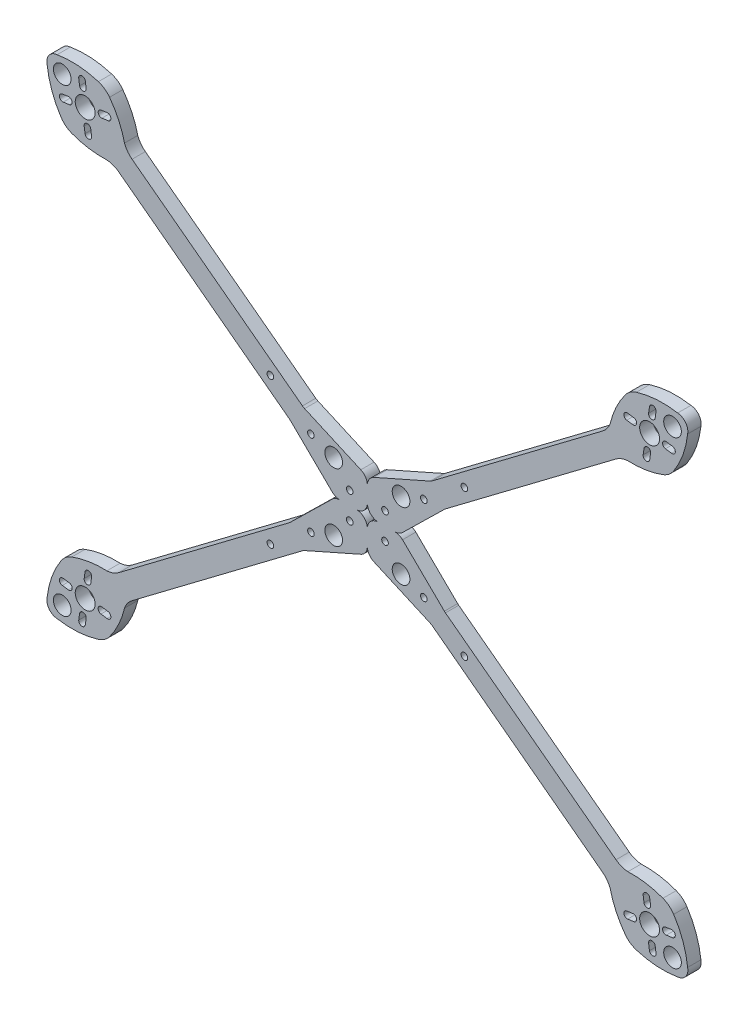
from build123d import *

# Parameters (mm, degrees)
CROQUIS1_R              = 4
CROQUIS1_R_2            = 4.5
CROQUIS1_R_3            = 1.5
SALIENTE_EXTRUIR1_DEPTH = 6


with BuildPart() as part:
    # Croquis1 → Saliente-Extruir1 (new body)
    with BuildSketch(Plane.XY):
        with BuildLine():
            ThreePointArc((-124.30149571, 56.412363794), (-122.413191065, 56.782643979), (-120.804567137, 57.838641566))
            Line((-120.804567137, 57.838641566), (-101.858135084, 76.377944673))
            ThreePointArc((-101.858135084, 76.377944673), (-101.620962129, 76.595527407), (-101.370281627, 76.797399996))
            Line((-101.370281627, 76.797399996), (-24.160029782, 134.979497983))
            ThreePointArc((-24.160029782, 134.979497983), (-21.611419756, 136.371964278), (-18.770175683, 136.973385563))
            ThreePointArc((-18.770175683, 136.973385563), (-10.706717103, 137.416502238), (-2.896595227, 139.470209357))
            ThreePointArc((-2.896595227, 139.470209357), (-0.16079463, 141.022813745), (1.957331737, 143.348480526))
            ThreePointArc((1.957331737, 143.348480526), (6.169165818, 151.795844616), (8.284256186, 160.994969527))
            ThreePointArc((8.284256186, 160.994969527), (7.378957738, 165.006508056), (3.772353479, 166.98246665))
            ThreePointArc((3.772353479, 166.98246665), (-5.653410851, 167.484933762), (-14.934477191, 165.764668091))
            ThreePointArc((-14.934477191, 165.764668091), (-17.753886337, 164.36963499), (-20.000434306, 162.167770437))
            ThreePointArc((-20.000434306, 162.167770437), (-24.127345636, 155.226277836), (-26.775887124, 147.597323475))
            ThreePointArc((-26.775887124, 147.597323475), (-28.137163373, 145.031918552), (-30.178180014, 142.965853083))
            Line((-30.178180014, 142.965853083), (-107.335086675, 84.823953575))
            ThreePointArc((-107.335086675, 84.823953575), (-107.810669131, 84.506514587), (-108.319384217, 84.245449184))
            Line((-108.319384217, 84.245449184), (-133.755116638, 72.980076558))
            ThreePointArc((-133.755116638, 72.980076558), (-135.921036372, 71.135674592), (-136.730339063, 68.408394616))
            ThreePointArc((-136.730339063, 68.408394616), (-137.539641754, 71.135674592), (-139.705561488, 72.980076558))
            Line((-139.705561488, 72.980076558), (-165.141293909, 84.245449184))
            ThreePointArc((-165.141293909, 84.245449184), (-165.650008995, 84.506514587), (-166.125591451, 84.823953575))
            Line((-166.125591451, 84.823953575), (-243.282498112, 142.965853083))
            ThreePointArc((-243.282498112, 142.965853083), (-245.323514753, 145.031918552), (-246.684791002, 147.597323475))
            ThreePointArc((-246.684791002, 147.597323475), (-249.33333249, 155.226277836), (-253.46024382, 162.167770437))
            ThreePointArc((-253.46024382, 162.167770437), (-255.706791789, 164.36963499), (-258.526200935, 165.764668091))
            ThreePointArc((-258.526200935, 165.764668091), (-267.807267276, 167.484933762), (-277.233031605, 166.98246665))
            ThreePointArc((-277.233031605, 166.98246665), (-280.839635864, 165.006508056), (-281.744934312, 160.994969527))
            ThreePointArc((-281.744934312, 160.994969527), (-279.629843944, 151.795844616), (-275.418009863, 143.348480526))
            ThreePointArc((-275.418009863, 143.348480526), (-273.299883496, 141.022813745), (-270.564082899, 139.470209357))
            ThreePointArc((-270.564082899, 139.470209357), (-262.753961023, 137.416502238), (-254.690502443, 136.973385563))
            ThreePointArc((-254.690502443, 136.973385563), (-251.84925837, 136.371964278), (-249.300648344, 134.979497983))
            Line((-249.300648344, 134.979497983), (-172.090396499, 76.797399996))
            ThreePointArc((-172.090396499, 76.797399996), (-171.839715997, 76.595527407), (-171.602543042, 76.377944673))
            Line((-171.602543042, 76.377944673), (-152.656110989, 57.838641566))
            ThreePointArc((-152.656110989, 57.838641566), (-151.047487061, 56.782643979), (-149.159182416, 56.412363794))
            ThreePointArc((-149.159182416, 56.412363794), (-151.047487061, 56.042083609), (-152.656110989, 54.986086021))
            Line((-152.656110989, 54.986086021), (-171.602543042, 36.446782915))
            ThreePointArc((-171.602543042, 36.446782915), (-171.839715997, 36.229200181), (-172.090396499, 36.027327592))
            Line((-172.090396499, 36.027327592), (-249.300648344, -22.154770395))
            ThreePointArc((-249.300648344, -22.154770395), (-251.84925837, -23.54723669), (-254.690502443, -24.148657976))
            ThreePointArc((-254.690502443, -24.148657976), (-262.753961023, -24.591774651), (-270.564082899, -26.645481769))
            ThreePointArc((-270.564082899, -26.645481769), (-273.299883496, -28.198086157), (-275.418009863, -30.523752939))
            ThreePointArc((-275.418009863, -30.523752939), (-279.629843944, -38.971117028), (-281.744934312, -48.170241939))
            ThreePointArc((-281.744934312, -48.170241939), (-280.839635864, -52.181780468), (-277.233031605, -54.157739063))
            ThreePointArc((-277.233031605, -54.157739063), (-267.807267276, -54.660206174), (-258.526200935, -52.939940504))
            ThreePointArc((-258.526200935, -52.939940504), (-255.706791789, -51.544907402), (-253.46024382, -49.343042849))
            ThreePointArc((-253.46024382, -49.343042849), (-249.33333249, -42.401550248), (-246.684791002, -34.772595888))
            ThreePointArc((-246.684791002, -34.772595888), (-245.323514753, -32.207190964), (-243.282498112, -30.141125496))
            Line((-243.282498112, -30.141125496), (-166.125591451, 28.000774013))
            ThreePointArc((-166.125591451, 28.000774013), (-165.650008995, 28.318213001), (-165.141293909, 28.579278404))
            Line((-165.141293909, 28.579278404), (-139.705561488, 39.84465103))
            ThreePointArc((-139.705561488, 39.84465103), (-137.539641754, 41.689052996), (-136.730339063, 44.416332971))
            ThreePointArc((-136.730339063, 44.416332971), (-135.921036372, 41.689052996), (-133.755116638, 39.84465103))
            Line((-133.755116638, 39.84465103), (-108.319384217, 28.579278404))
            ThreePointArc((-108.319384217, 28.579278404), (-107.810669131, 28.318213001), (-107.335086675, 28.000774013))
            Line((-107.335086675, 28.000774013), (-30.178180014, -30.141125496))
            ThreePointArc((-30.178180014, -30.141125496), (-28.137163373, -32.207190964), (-26.775887124, -34.772595888))
            ThreePointArc((-26.775887124, -34.772595888), (-24.127345636, -42.401550248), (-20.000434306, -49.343042849))
            ThreePointArc((-20.000434306, -49.343042849), (-17.753886337, -51.544907402), (-14.934477191, -52.939940504))
            ThreePointArc((-14.934477191, -52.939940504), (-5.653410851, -54.660206174), (3.772353479, -54.157739063))
            ThreePointArc((3.772353479, -54.157739063), (7.378957738, -52.181780468), (8.284256186, -48.170241939))
            ThreePointArc((8.284256186, -48.170241939), (6.169165818, -38.971117028), (1.957331737, -30.523752939))
            ThreePointArc((1.957331737, -30.523752939), (-0.16079463, -28.198086157), (-2.896595227, -26.645481769))
            ThreePointArc((-2.896595227, -26.645481769), (-10.706717103, -24.591774651), (-18.770175683, -24.148657976))
            ThreePointArc((-18.770175683, -24.148657976), (-21.611419756, -23.54723669), (-24.160029782, -22.154770395))
            Line((-24.160029782, -22.154770395), (-101.370281627, 36.027327592))
            ThreePointArc((-101.370281627, 36.027327592), (-101.620962129, 36.229200181), (-101.858135084, 36.446782915))
            Line((-101.858135084, 36.446782915), (-120.804567137, 54.986086021))
            ThreePointArc((-120.804567137, 54.986086021), (-122.413191065, 56.042083609), (-124.30149571, 56.412363794))
        make_face()
        with BuildLine():
            ThreePointArc((-141.730339063, 56.412363794), (-138.194805157, 57.876829888), (-136.730339063, 61.412363794))
            ThreePointArc((-136.730339063, 61.412363794), (-135.265872969, 57.876829888), (-131.730339063, 56.412363794))
            ThreePointArc((-131.730339063, 56.412363794), (-135.265872969, 54.9478977), (-136.730339063, 51.412363794))
            ThreePointArc((-136.730339063, 51.412363794), (-138.194805157, 54.9478977), (-141.730339063, 56.412363794))
        make_face(mode=Mode.SUBTRACT)
        with Locations((-274.894282301, -47.701635211)):
            Circle(CROQUIS1_R, mode=Mode.SUBTRACT)
        with BuildLine():
            ThreePointArc((-267.034262376, -47.046777371), (-265.340100621, -45.770134919), (-264.063458169, -47.464296674))
            Line((-264.063458169, -47.464296674), (-264.453142852, -50.237047266))
            ThreePointArc((-264.453142852, -50.237047266), (-266.147304607, -51.513689718), (-267.423947058, -49.819527963))
            Line((-267.423947058, -49.819527963), (-267.034262376, -47.046777371))
        make_face(mode=Mode.SUBTRACT)
        with BuildLine():
            ThreePointArc((-271.680758131, -37.355798205), (-270.404115679, -39.04995996), (-272.098277434, -40.326602411))
            Line((-272.098277434, -40.326602411), (-274.871028026, -39.936917729))
            ThreePointArc((-274.871028026, -39.936917729), (-276.147670478, -38.242755974), (-274.453508724, -36.966113522))
            Line((-274.453508724, -36.966113522), (-271.680758131, -37.355798205))
        make_face(mode=Mode.SUBTRACT)
        with Locations((-264.51202067, -39.87803991)):
            Circle(CROQUIS1_R_2, mode=Mode.SUBTRACT)
        with BuildLine():
            ThreePointArc((-257.34328321, -42.400281616), (-258.619925661, -40.706119861), (-256.925763907, -39.429477409))
            Line((-256.925763907, -39.429477409), (-254.153013314, -39.819162092))
            ThreePointArc((-254.153013314, -39.819162092), (-252.876370863, -41.513323847), (-254.570532617, -42.789966298))
            Line((-254.570532617, -42.789966298), (-257.34328321, -42.400281616))
        make_face(mode=Mode.SUBTRACT)
        with BuildLine():
            ThreePointArc((-261.989778965, -32.70930245), (-263.68394072, -33.985944901), (-264.960583171, -32.291783147))
            Line((-264.960583171, -32.291783147), (-264.570898489, -29.519032554))
            ThreePointArc((-264.570898489, -29.519032554), (-262.876736734, -28.242390103), (-261.600094282, -29.936551857))
            Line((-261.600094282, -29.936551857), (-261.989778965, -32.70930245))
        make_face(mode=Mode.SUBTRACT)
        with Locations((-180.655292116, 23.312537521)):
            Circle(CROQUIS1_R_3, mode=Mode.SUBTRACT)
        with Locations((-162.290622468, 37.151308712)):
            Circle(CROQUIS1_R_3, mode=Mode.SUBTRACT)
        with Locations((-151.980339063, 41.162363794)):
            Circle(CROQUIS1_R, mode=Mode.SUBTRACT)
        with Locations((-144.716694164, 50.394213562)):
            Circle(CROQUIS1_R_3, mode=Mode.SUBTRACT)
        with Locations((-144.716694164, 62.430514025)):
            Circle(CROQUIS1_R_3, mode=Mode.SUBTRACT)
        with Locations((-162.290622468, 75.673418875)):
            Circle(CROQUIS1_R_3, mode=Mode.SUBTRACT)
        with Locations((-151.980339063, 71.662363794)):
            Circle(CROQUIS1_R, mode=Mode.SUBTRACT)
        with Locations((-180.655292116, 89.512190067)):
            Circle(CROQUIS1_R_3, mode=Mode.SUBTRACT)
        with BuildLine():
            Line((-261.989778965, 145.534030037), (-261.600094282, 142.761279445))
            ThreePointArc((-261.600094282, 142.761279445), (-262.876736734, 141.06711769), (-264.570898489, 142.343760142))
            Line((-264.570898489, 142.343760142), (-264.960583171, 145.116510735))
            ThreePointArc((-264.960583171, 145.116510735), (-263.68394072, 146.810672489), (-261.989778965, 145.534030037))
        make_face(mode=Mode.SUBTRACT)
        with BuildLine():
            Line((-271.680758131, 150.180525793), (-274.453508724, 149.79084111))
            ThreePointArc((-274.453508724, 149.79084111), (-276.147670478, 151.067483562), (-274.871028026, 152.761645316))
            Line((-274.871028026, 152.761645316), (-272.098277434, 153.151329999))
            ThreePointArc((-272.098277434, 153.151329999), (-270.404115679, 151.874687547), (-271.680758131, 150.180525793))
        make_face(mode=Mode.SUBTRACT)
        with Locations((-264.51202067, 152.702767498)):
            Circle(CROQUIS1_R_2, mode=Mode.SUBTRACT)
        with Locations((-274.894282301, 160.526362799)):
            Circle(CROQUIS1_R, mode=Mode.SUBTRACT)
        with BuildLine():
            Line((-267.034262376, 159.871504959), (-267.423947058, 162.644255551))
            ThreePointArc((-267.423947058, 162.644255551), (-266.147304607, 164.338417306), (-264.453142852, 163.061774854))
            Line((-264.453142852, 163.061774854), (-264.063458169, 160.289024262))
            ThreePointArc((-264.063458169, 160.289024262), (-265.340100621, 158.594862507), (-267.034262376, 159.871504959))
        make_face(mode=Mode.SUBTRACT)
        with BuildLine():
            Line((-257.34328321, 155.225009203), (-254.570532617, 155.614693886))
            ThreePointArc((-254.570532617, 155.614693886), (-252.876370863, 154.338051434), (-254.153013314, 152.64388968))
            Line((-254.153013314, 152.64388968), (-256.925763907, 152.254204997))
            ThreePointArc((-256.925763907, 152.254204997), (-258.619925661, 153.530847449), (-257.34328321, 155.225009203))
        make_face(mode=Mode.SUBTRACT)
        with Locations((-128.743983963, 62.430514025)):
            Circle(CROQUIS1_R_3, mode=Mode.SUBTRACT)
        with Locations((-121.480339063, 71.662363794)):
            Circle(CROQUIS1_R, mode=Mode.SUBTRACT)
        with Locations((-111.170055658, 75.673418875)):
            Circle(CROQUIS1_R_3, mode=Mode.SUBTRACT)
        with Locations((-92.80538601, 89.512190067)):
            Circle(CROQUIS1_R_3, mode=Mode.SUBTRACT)
        with BuildLine():
            ThreePointArc((-11.470899161, 145.534030037), (-9.776737406, 146.810672489), (-8.500094955, 145.116510735))
            Line((-8.500094955, 145.116510735), (-8.889779637, 142.343760142))
            ThreePointArc((-8.889779637, 142.343760142), (-10.583941392, 141.06711769), (-11.860583844, 142.761279445))
            Line((-11.860583844, 142.761279445), (-11.470899161, 145.534030037))
        make_face(mode=Mode.SUBTRACT)
        with BuildLine():
            ThreePointArc((-16.117394916, 155.225009203), (-14.840752465, 153.530847449), (-16.534914219, 152.254204997))
            Line((-16.534914219, 152.254204997), (-19.307664812, 152.64388968))
            ThreePointArc((-19.307664812, 152.64388968), (-20.584307263, 154.338051434), (-18.890145509, 155.614693886))
            Line((-18.890145509, 155.614693886), (-16.117394916, 155.225009203))
        make_face(mode=Mode.SUBTRACT)
        with Locations((-8.948657456, 152.702767498)):
            Circle(CROQUIS1_R_2, mode=Mode.SUBTRACT)
        with BuildLine():
            ThreePointArc((-1.779919995, 150.180525793), (-3.056562447, 151.874687547), (-1.362400692, 153.151329999))
            Line((-1.362400692, 153.151329999), (1.4103499, 152.761645316))
            ThreePointArc((1.4103499, 152.761645316), (2.686992352, 151.067483562), (0.992830597, 149.79084111))
            Line((0.992830597, 149.79084111), (-1.779919995, 150.180525793))
        make_face(mode=Mode.SUBTRACT)
        with BuildLine():
            ThreePointArc((-6.42641575, 159.871504959), (-8.120577505, 158.594862507), (-9.397219957, 160.289024262))
            Line((-9.397219957, 160.289024262), (-9.007535274, 163.061774854))
            ThreePointArc((-9.007535274, 163.061774854), (-7.313373519, 164.338417306), (-6.036731068, 162.644255551))
            Line((-6.036731068, 162.644255551), (-6.42641575, 159.871504959))
        make_face(mode=Mode.SUBTRACT)
        with Locations((1.433604175, 160.526362799)):
            Circle(CROQUIS1_R, mode=Mode.SUBTRACT)
        with Locations((-128.743983963, 50.394213562)):
            Circle(CROQUIS1_R_3, mode=Mode.SUBTRACT)
        with BuildLine():
            Line((-16.117394916, -42.400281616), (-18.890145509, -42.789966298))
            ThreePointArc((-18.890145509, -42.789966298), (-20.584307263, -41.513323847), (-19.307664812, -39.819162092))
            Line((-19.307664812, -39.819162092), (-16.534914219, -39.429477409))
            ThreePointArc((-16.534914219, -39.429477409), (-14.840752465, -40.706119861), (-16.117394916, -42.400281616))
        make_face(mode=Mode.SUBTRACT)
        with BuildLine():
            Line((-6.42641575, -47.046777371), (-6.036731068, -49.819527963))
            ThreePointArc((-6.036731068, -49.819527963), (-7.313373519, -51.513689718), (-9.007535274, -50.237047266))
            Line((-9.007535274, -50.237047266), (-9.397219957, -47.464296674))
            ThreePointArc((-9.397219957, -47.464296674), (-8.120577505, -45.770134919), (-6.42641575, -47.046777371))
        make_face(mode=Mode.SUBTRACT)
        with Locations((1.433604175, -47.701635211)):
            Circle(CROQUIS1_R, mode=Mode.SUBTRACT)
        with Locations((-8.948657456, -39.87803991)):
            Circle(CROQUIS1_R_2, mode=Mode.SUBTRACT)
        with BuildLine():
            Line((-1.779919995, -37.355798205), (0.992830597, -36.966113522))
            ThreePointArc((0.992830597, -36.966113522), (2.686992352, -38.242755974), (1.4103499, -39.936917729))
            Line((1.4103499, -39.936917729), (-1.362400692, -40.326602411))
            ThreePointArc((-1.362400692, -40.326602411), (-3.056562447, -39.04995996), (-1.779919995, -37.355798205))
        make_face(mode=Mode.SUBTRACT)
        with BuildLine():
            Line((-11.470899161, -32.70930245), (-11.860583844, -29.936551857))
            ThreePointArc((-11.860583844, -29.936551857), (-10.583941392, -28.242390103), (-8.889779637, -29.519032554))
            Line((-8.889779637, -29.519032554), (-8.500094955, -32.291783147))
            ThreePointArc((-8.500094955, -32.291783147), (-9.776737406, -33.985944901), (-11.470899161, -32.70930245))
        make_face(mode=Mode.SUBTRACT)
        with Locations((-92.80538601, 23.312537521)):
            Circle(CROQUIS1_R_3, mode=Mode.SUBTRACT)
        with Locations((-111.170055658, 37.151308712)):
            Circle(CROQUIS1_R_3, mode=Mode.SUBTRACT)
        with Locations((-121.480339063, 41.162363794)):
            Circle(CROQUIS1_R, mode=Mode.SUBTRACT)
    extrude(amount=SALIENTE_EXTRUIR1_DEPTH)


solid = part.part
